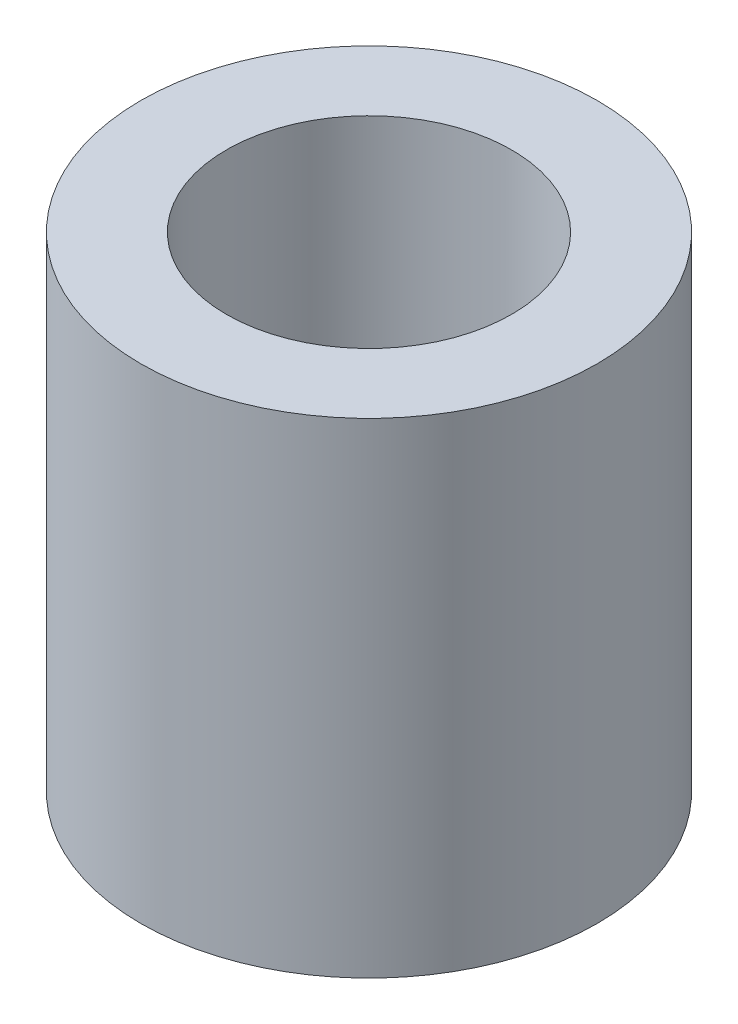
from build123d import *

# Parameters (mm, degrees)
SKETCH_1_R      = 4
SKETCH_1_R_2    = 2.5
EXTRUDE_1_DEPTH = 8.5


with BuildPart() as part:
    # 草图1 → 凸台-拉伸1 (new body)
    with BuildSketch(Plane(origin=(0, 0, 0), x_dir=(1, 0, 0), z_dir=(0, 1, 0))):
        with Locations(Location((0, 0, 0), (0, 0, 270))):
            Circle(SKETCH_1_R)
        with Locations(Location((0, 0, 0), (0, 0, 270))):
            Circle(SKETCH_1_R_2, mode=Mode.SUBTRACT)
    extrude(amount=EXTRUDE_1_DEPTH)


solid = part.part
